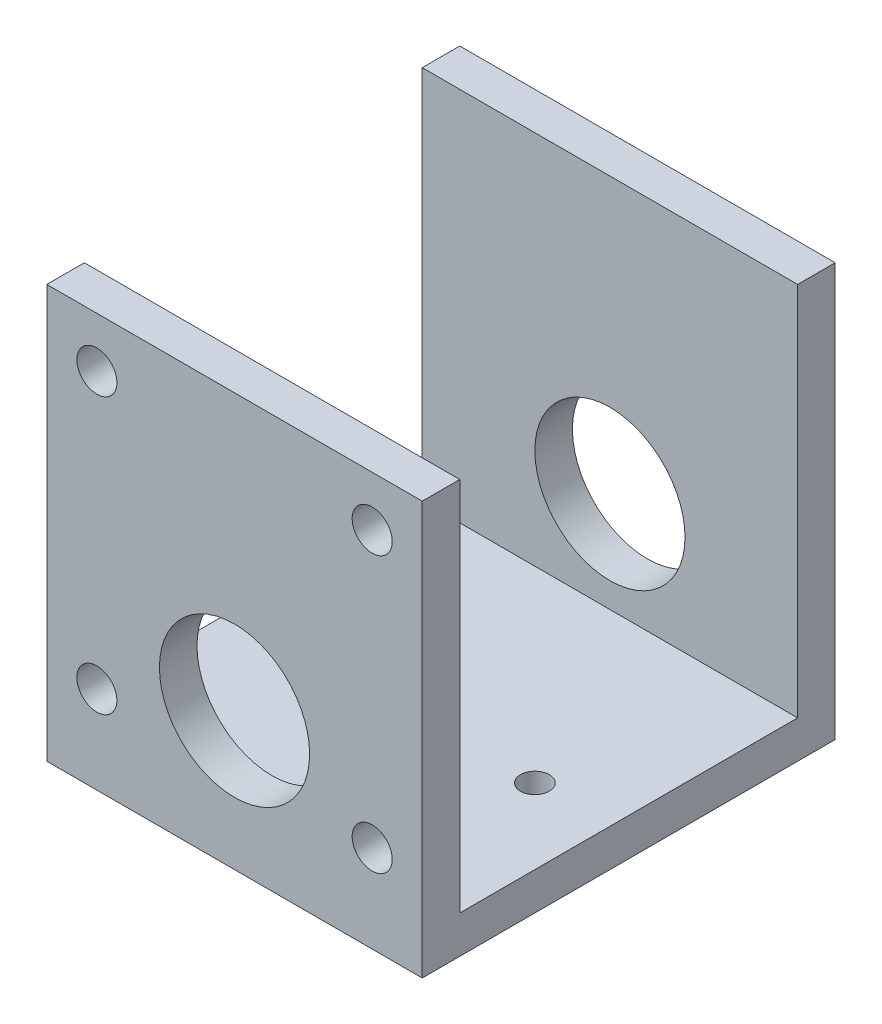
from build123d import *

# Parameters (mm, degrees)
SKETCH1_W           = 30
SKETCH1_H           = 30
SKETCH1_R           = 1.15
BOSS_EXTRUDE1_DEPTH = 3
SKETCH2_W           = 30
SKETCH2_H           = 3
BOSS_EXTRUDE2_DEPTH = 30
CUT_EXTRUDE1_REACH  = 55.749
SKETCH3_R           = 6
SKETCH4_W           = 30
SKETCH4_H           = 33
SKETCH4_R           = 6
BOSS_EXTRUDE3_DEPTH = 3
CUT_EXTRUDE3_REACH  = 57.48
SKETCH5_R           = 1.6


with BuildPart() as part:
    # Sketch1 → Boss-Extrude1 (new body)
    with BuildSketch(Plane(origin=(0, 0, 0), x_dir=(1, 0, 0), z_dir=(0, 1, 0))):
        with Locations((15, 15)):
            Rectangle(SKETCH1_W, SKETCH1_H)
        with Locations(Location((5.999988, 12, 0), (0, 0, 270))):
            Circle(SKETCH1_R, mode=Mode.SUBTRACT)
        with Locations(Location((23.999988, 12, 0), (0, 0, 270))):
            Circle(SKETCH1_R, mode=Mode.SUBTRACT)
    extrude(amount=BOSS_EXTRUDE1_DEPTH)

    # Sketch2 → Boss-Extrude2 (add)
    with BuildSketch(Plane(origin=(0, 3, 0), x_dir=(1, 0, 0), z_dir=(0, 1, 0))):
        with Locations((15, 28.5)):
            Rectangle(SKETCH2_W, SKETCH2_H)
    extrude(amount=BOSS_EXTRUDE2_DEPTH)

    # Sketch3 → Cut-Extrude1 (cut, up to next)
    with BuildSketch(Plane(origin=(0, 0, -30), x_dir=(-1, 0, 0), z_dir=(0, 0, -1)), mode=Mode.PRIVATE) as cut_extrude1_sk1:
        with Locations((-15, 11)):
            Circle(SKETCH3_R)
    cut_extrude1_tool1 = extrude(cut_extrude1_sk1.sketch, amount=-CUT_EXTRUDE1_REACH, mode=Mode.PRIVATE) & part.part
    add(cut_extrude1_tool1.solids().sort_by_distance((15, 11, -30))[0], mode=Mode.SUBTRACT)

    # Sketch4 → Boss-Extrude3 (add)
    with BuildSketch(Plane.XY):
        with Locations((15, 16.5)):
            Rectangle(SKETCH4_W, SKETCH4_H)
        with Locations(Location((15, 11, 0), (0, 0, 180))):
            Circle(SKETCH4_R, mode=Mode.SUBTRACT)
    extrude(amount=BOSS_EXTRUDE3_DEPTH)

    # Sketch5 → Cut-Extrude3 (cut, up to next)
    with BuildSketch(Plane.XY.offset(3), mode=Mode.PRIVATE) as cut_extrude3_sk1:
        with Locations((26, 7)):
            Circle(SKETCH5_R)
    cut_extrude3_tool1 = extrude(cut_extrude3_sk1.sketch, amount=-CUT_EXTRUDE3_REACH, mode=Mode.PRIVATE) & part.part
    # Sketch5 → Cut-Extrude3 (cut, up to next)
    with BuildSketch(Plane.XY.offset(3), mode=Mode.PRIVATE) as cut_extrude3_sk2:
        with Locations((4, 7)):
            Circle(SKETCH5_R)
    cut_extrude3_tool2 = extrude(cut_extrude3_sk2.sketch, amount=-CUT_EXTRUDE3_REACH, mode=Mode.PRIVATE) & part.part
    # Sketch5 → Cut-Extrude3 (cut, up to next)
    with BuildSketch(Plane.XY.offset(3), mode=Mode.PRIVATE) as cut_extrude3_sk3:
        with Locations((4, 29)):
            Circle(SKETCH5_R)
    cut_extrude3_tool3 = extrude(cut_extrude3_sk3.sketch, amount=-CUT_EXTRUDE3_REACH, mode=Mode.PRIVATE) & part.part
    # Sketch5 → Cut-Extrude3 (cut, up to next)
    with BuildSketch(Plane.XY.offset(3), mode=Mode.PRIVATE) as cut_extrude3_sk4:
        with Locations((26, 29)):
            Circle(SKETCH5_R)
    cut_extrude3_tool4 = extrude(cut_extrude3_sk4.sketch, amount=-CUT_EXTRUDE3_REACH, mode=Mode.PRIVATE) & part.part
    add(cut_extrude3_tool1.solids().sort_by_distance((26, 7, 3))[0], mode=Mode.SUBTRACT)
    add(cut_extrude3_tool2.solids().sort_by_distance((4, 7, 3))[0], mode=Mode.SUBTRACT)
    add(cut_extrude3_tool3.solids().sort_by_distance((4, 29, 3))[0], mode=Mode.SUBTRACT)
    add(cut_extrude3_tool4.solids().sort_by_distance((26, 29, 3))[0], mode=Mode.SUBTRACT)


solid = part.part
